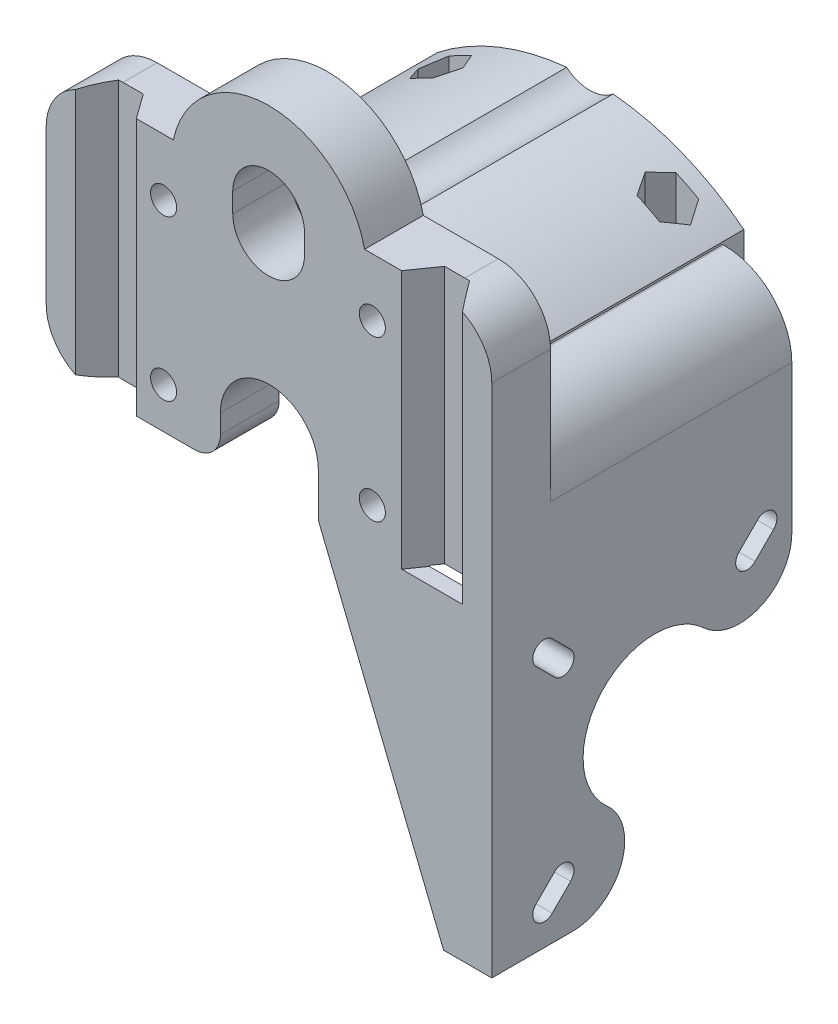
from build123d import *

# Parameters (mm, degrees)
SKETCH1_R               = 2
BOSS_EXTRUDE1_DEPTH     = 9
BOSS_EXTRUDE2_DEPTH     = 40.25
CUT_EXTRUDE1_DEPTH      = 50
SKETCH6_W               = 3.25
SKETCH6_H               = 24.113806611
CUT_EXTRUDE2_DEPTH      = 10.6
CUT_EXTRUDE3_DEPTH      = 39.5
CUT_EXTRUDE3_DEPTH_BACK = 39.5
SKETCH7_R               = 1.8
CUT_EXTRUDE4_DEPTH      = 20.85
SKETCH9_R               = 4.05
CUT_EXTRUDE5_DEPTH      = 2.4
CUT_EXTRUDE6_DEPTH      = 6.5


with BuildPart() as part:
    # Sketch1 → Boss-Extrude1 (new body)
    with BuildSketch(Plane.XY):
        with BuildLine():
            Line((0, 0), (-7.3836, 0))
            Line((-7.3836, 0), (-26.6, 47.5))
            Line((-26.6, 47.5), (-26.6, 54.25))
            ThreePointArc((-26.6, 54.25), (-34.1, 61.75), (-41.6, 54.25))
            Line((-41.6, 54.25), (-41.6, 51.364872675))
            ThreePointArc((-41.6, 51.364872675), (-42.771572875, 48.53644555), (-45.6, 47.364872675))
            Line((-45.6, 47.364872675), (-60.316706428, 47.364872675))
            ThreePointArc((-60.316706428, 47.364872675), (-65.973560677, 49.708018426), (-68.316706428, 55.364872675))
            Line((-68.316706428, 55.364872675), (-68.316706428, 78.864872675))
            ThreePointArc((-68.316706428, 78.864872675), (-65.973560677, 84.521726925), (-60.316706428, 86.864872675))
            Line((-60.316706428, 86.864872675), (-48.816706428, 86.864872675))
            ThreePointArc((-48.816706428, 86.864872675), (-34.212822301, 98.749840665), (-19.5, 87))
            Line((-19.5, 87), (-8, 87))
            ThreePointArc((-8, 87), (-2.343145751, 84.656854249), (0, 79))
            Line((0, 79), (0, 0))
        make_face()
        with Locations((-50.316706428, 78.114872675)):
            Circle(SKETCH1_R, mode=Mode.SUBTRACT)
        with Locations((-18.316706428, 78.114872675)):
            Circle(SKETCH1_R, mode=Mode.SUBTRACT)
        with Locations((-50.316706428, 53.614872675)):
            Circle(SKETCH1_R, mode=Mode.SUBTRACT)
        with Locations((-18.316706428, 53.614872675)):
            Circle(SKETCH1_R, mode=Mode.SUBTRACT)
    extrude(amount=BOSS_EXTRUDE1_DEPTH)

    # Sketch3 → Boss-Extrude2 (add)
    with BuildSketch(Plane(origin=(0, 0, 0), x_dir=(-1, 0, 0), z_dir=(0, 0, -1))):
        with BuildLine():
            Line((0, 0), (5.4, 0))
            Line((5.4, 0), (5.4, 58.675))
            ThreePointArc((5.4, 58.675), (6.886433085, 62.263566915), (10.475, 63.75))
            Line((10.475, 63.75), (57.6, 63.75))
            Line((57.6, 63.75), (57.6, 69.45))
            ThreePointArc((57.6, 69.45), (34.1, 77.587816557), (10.6, 69.45))
            Line((10.6, 69.45), (10.6, 69.1))
            Line((10.6, 69.1), (10.375, 69.1))
            ThreePointArc((10.375, 69.1), (3.038767145, 66.061232855), (0, 58.725))
            Line((0, 58.725), (0, 0))
        make_face()
    extrude(amount=BOSS_EXTRUDE2_DEPTH)

    # Sketch5 → Cut-Extrude1 (cut)
    with BuildSketch(Plane.XY.offset(9)):
        with BuildLine():
            Line((-28.716706428, 84.614872675), (-28.716706428, 81.614872675))
            ThreePointArc((-28.716706428, 81.614872675), (-34.216706428, 76.114872675), (-39.716706428, 81.614872675))
            Line((-39.716706428, 81.614872675), (-39.716706428, 84.614872675))
            ThreePointArc((-39.716706428, 84.614872675), (-34.216706428, 90.114872675), (-28.716706428, 84.614872675))
        make_face()
    extrude(amount=-CUT_EXTRUDE1_DEPTH, mode=Mode.SUBTRACT)

    # Sketch6 → Cut-Extrude2 (cut)
    with BuildSketch(Plane(origin=(0, 0, 0), x_dir=(0, 0, -1), z_dir=(1, 0, 0))):
        with BuildLine():
            Line((37, 58.725), (37, 36.056406461))
            ThreePointArc((37, 36.056406461), (32.178877657, 28.715102977), (23.526315789, 30.222130056))
            ThreePointArc((23.526315789, 30.222130056), (7.877678535, 29.618078863), (8.691491696, 13.978947368))
            ThreePointArc((8.691491696, 13.978947368), (10.853899034, 5.156725387), (3.37621293, 0))
            Line((3.37621293, 0), (37.9285464, 0))
            Line((37.9285464, 0), (40.25, 0))
            Line((40.25, 0), (40.25, 58.725))
            Line((40.25, 58.725), (37, 58.725))
        make_face()
        with BuildLine():
            Line((3.096104185, 37.603623706), (0.26725, 40.431623706))
            ThreePointArc((0.26725, 40.431623706), (-2.207623706, 40.43125), (-2.20725, 37.956376294))
            Line((-2.20725, 37.956376294), (0.621604185, 35.128376294))
            ThreePointArc((0.621604185, 35.128376294), (3.096477891, 35.12875), (3.096104185, 37.603623706))
        make_face()
        with BuildLine():
            ThreePointArc((31.73275, 40.431623706), (34.207623706, 40.43125), (34.20725, 37.956376294))
            Line((34.20725, 37.956376294), (31.378395815, 35.128376294))
            ThreePointArc((31.378395815, 35.128376294), (28.903522109, 35.12875), (28.903895815, 37.603623706))
            Line((28.903895815, 37.603623706), (31.73275, 40.431623706))
        make_face()
        with BuildLine():
            ThreePointArc((0.26725, 3.968376294), (-2.207623706, 3.96875), (-2.20725, 6.443623706))
            Line((-2.20725, 6.443623706), (0.621604185, 9.271623706))
            ThreePointArc((0.621604185, 9.271623706), (3.096477891, 9.27125), (3.096104185, 6.796376294))
            Line((3.096104185, 6.796376294), (0.26725, 3.968376294))
        make_face()
        with Locations((38.625, 70.781903306)):
            Rectangle(SKETCH6_W, SKETCH6_H)
    extrude(amount=-CUT_EXTRUDE2_DEPTH, mode=Mode.SUBTRACT)

    # Sketch7 → Cut-Extrude3 (cut, two sides: drawn at the far end of the back side and taken through both)
    with BuildSketch(Plane(origin=(0, 86.864872675, 0), x_dir=(1, 0, 0), z_dir=(0, 1, 0)).offset(-CUT_EXTRUDE3_DEPTH_BACK)):
        with Locations(Location((-51.6, 34.75, 0), (0, 0, 90))):
            Circle(SKETCH7_R)
        with Locations(Location((-51.6, 6, 0), (0, 0, 90))):
            Circle(SKETCH7_R)
        with Locations(Location((-16.745188355, 6.033054654, 0), (0, 0, 90))):
            Circle(SKETCH7_R)
        with Locations(Location((-16.799718585, 34.78300294, 0), (0, 0, 90))):
            Circle(SKETCH7_R)
        Polygon((-13.833, -9), (-11.1, -5.12), (-7.3, -5.12), (-4.5, -9), align=None)
        Polygon((-63.816706428, -9), (-61.016706428, -5.217), (-57.216706428, -5.217), (-54.486706428, -9), align=None)
    extrude(amount=CUT_EXTRUDE3_DEPTH + CUT_EXTRUDE3_DEPTH_BACK, mode=Mode.SUBTRACT)

    # Sketch8 → Cut-Extrude4 (cut)
    with BuildSketch(Plane(origin=(0, 86.864872675, 0), x_dir=(1, 0, 0), z_dir=(0, 1, 0))):
        Polygon((-48.135898385, 34.75), (-49.867949192, 37.75), (-53.332050808, 37.75), (-55.064101615, 34.75), (-53.332050808, 31.75), (-49.867949192, 31.75), align=None)
        Polygon((-48.135898385, 6), (-49.867949192, 9), (-53.332050808, 9), (-55.064101615, 6), (-53.332050808, 3), (-49.867949192, 3), align=None)
        Polygon((-18.469686835, 9.036434754), (-15.005594549, 9.044474276), (-13.266585975, 6.048502117), (-14.991669687, 3.044490435), (-18.455761973, 3.036450912), (-20.194770547, 6.032423072), align=None)
        Polygon((-18.522485268, 31.786373486), (-20.261493842, 34.782345646), (-18.53641013, 37.786357328), (-15.072317844, 37.79439685), (-13.33330927, 34.798424691), (-15.058392982, 31.794413009), align=None)
    extrude(amount=-CUT_EXTRUDE4_DEPTH, mode=Mode.SUBTRACT)

    # Sketch9 → Cut-Extrude5 (cut)
    with BuildSketch(Plane(origin=(0, 0, 0), x_dir=(-1, 0, 0), z_dir=(0, 0, -1))):
        with Locations((18.316706428, 78.114872675)):
            Circle(SKETCH9_R)
        with Locations((50.316706428, 78.114872675)):
            Circle(SKETCH9_R)
        with Locations((18.316706428, 53.614872675)):
            Circle(SKETCH9_R)
        with Locations((50.316706428, 53.614872675)):
            Circle(SKETCH9_R)
    extrude(amount=-CUT_EXTRUDE5_DEPTH, mode=Mode.SUBTRACT)

    # Sketch10 → Cut-Extrude6 (cut)
    with BuildSketch(Plane(origin=(0, 0, 0), x_dir=(-1, 0, 0), z_dir=(0, 0, -1))):
        Polygon((26.6, 47.5), (5.4, 47.5), (5.4, 0), (7.3836, 0), align=None)
    extrude(amount=-CUT_EXTRUDE6_DEPTH, mode=Mode.SUBTRACT)


solid = part.part
